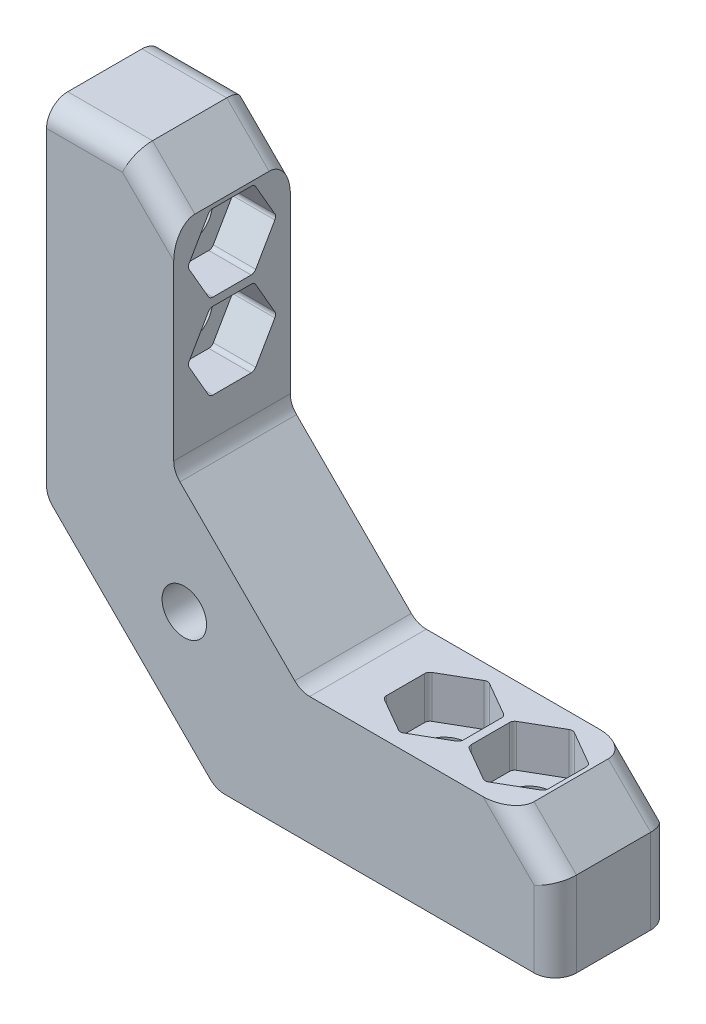
from build123d import *

# Parameters (mm, degrees)
EXTRUDE_1_DEPTH     = 11
SKETCH_2_R          = 2.15
CUT_EXTRUDE_1_DEPTH = 69.767724988
CUT_EXTRUDE_2_DEPTH = 4
FILLET_1_R          = 2
CHAMFER_1_SIZE      = 4
FILLET_2_R          = 2
FILLET_3_R          = 0.5
SKETCH_4_R          = 2.1
CUT_EXTRUDE_3_DEPTH = 69.767724988


with BuildPart() as part:
    # 草图1 → 凸台-拉伸1 (new body)
    with BuildSketch(Plane.XY):
        Polygon((0, 16), (16, 0), (48, 0), (48, 12), (24, 12), (12, 24), (12, 48), (0, 48), align=None)
    extrude(amount=EXTRUDE_1_DEPTH)

    # 草图2 → 切除-拉伸1 (cut, symmetric)
    with BuildSketch(Plane.ZY):
        with Locations(Location((5.5, 40, 0), (0, 0, 270))):
            Circle(SKETCH_2_R)
        with Locations(Location((5.5, 32, 0), (0, 0, 270))):
            Circle(SKETCH_2_R)
    cut_extrude_1 = extrude(amount=CUT_EXTRUDE_1_DEPTH, both=True, mode=Mode.SUBTRACT)

    # 草图3 → 切除-拉伸2 (cut)
    with BuildSketch(Plane(origin=(12, 0, 0), x_dir=(0, 0, -1), z_dir=(1, 0, 0))):
        Polygon((-1.314210548, 40), (-3.407105274, 43.625), (-7.592894726, 43.625), (-9.685789452, 40), (-7.592894726, 36.375), (-3.407105274, 36.375), align=None)
        Polygon((-1.314210548, 32), (-3.407105274, 35.625), (-7.592894726, 35.625), (-9.685789452, 32), (-7.592894726, 28.375), (-3.407105274, 28.375), align=None)
    cut_extrude_2 = extrude(amount=-CUT_EXTRUDE_2_DEPTH, mode=Mode.SUBTRACT)

    # 镜向1: 切除-拉伸1, 切除-拉伸2 across plane
    add(cut_extrude_1.mirror(Plane(origin=(0, 0, 0), x_dir=(0, 0, 1), z_dir=(-0.7071067811865475, 0.7071067811865476, 0))), mode=Mode.SUBTRACT)
    add(cut_extrude_2.mirror(Plane(origin=(0, 0, 0), x_dir=(0, 0, 1), z_dir=(-0.7071067811865475, 0.7071067811865476, 0))), mode=Mode.SUBTRACT)

    # 圆角1
    fillet_1_edges = [part.edges().sort_by_distance(p)[0] for p in [
        (12, 24, 5.5),
        (24, 12, 5.5),
        (16, 0, 5.5),
        (0, 16, 5.5),
    ]]
    fillet(fillet_1_edges, radius=FILLET_1_R)

    # 倒角1
    chamfer_1_edges = [part.edges().sort_by_distance(p)[0] for p in [
        (12, 48, 5.5),
        (48, 12, 5.5),
    ]]
    chamfer(chamfer_1_edges, length=CHAMFER_1_SIZE)

    # 圆角2
    fillet_2_edges = [part.edges().sort_by_distance(p)[0] for p in [
        (48, 4, 0),
        (4, 48, 0),
        (10, 46, 0),
        (46, 10, 0),
        (4, 48, 11),
        (10, 46, 11),
        (46, 10, 11),
        (48, 4, 11),
    ]]
    fillet(fillet_2_edges, radius=FILLET_2_R)

    # 圆角3
    fillet_3_edges = [part.edges().sort_by_distance(p)[0] for p in [
        (28.375, 10, 3.407105274),
        (32, 10, 1.314210548),
        (35.625, 10, 3.407105274),
        (35.625, 10, 7.592894726),
        (32, 10, 9.685789452),
        (28.375, 10, 7.592894726),
        (10, 40, 1.314210548),
        (10, 36.375, 3.407105274),
        (10, 36.375, 7.592894726),
        (10, 40, 9.685789452),
        (10, 43.625, 7.592894726),
        (10, 43.625, 3.407105274),
        (10, 32, 1.314210548),
        (10, 28.375, 3.407105274),
        (10, 28.375, 7.592894726),
        (10, 32, 9.685789452),
        (10, 35.625, 7.592894726),
        (10, 35.625, 3.407105274),
        (36.375, 10, 3.407105274),
        (40, 10, 1.314210548),
        (43.625, 10, 3.407105274),
        (43.625, 10, 7.592894726),
        (40, 10, 9.685789452),
        (36.375, 10, 7.592894726),
    ]]
    fillet(fillet_3_edges, radius=FILLET_3_R)

    # 草图4 → 切除-拉伸3 (cut, through all)
    with BuildSketch(Plane.XY.offset(11)):
        with Locations((13, 13)):
            Circle(SKETCH_4_R)
    extrude(amount=-CUT_EXTRUDE_3_DEPTH, mode=Mode.SUBTRACT)


solid = part.part
